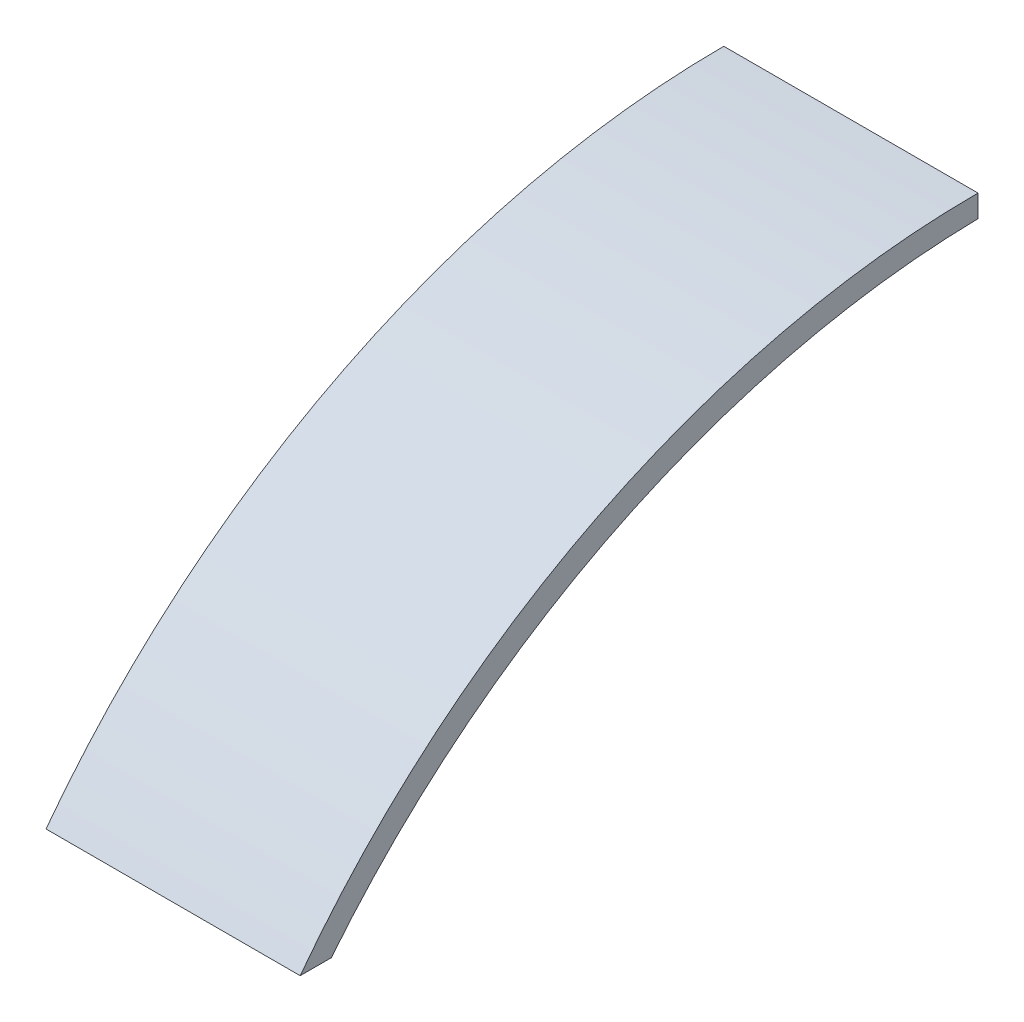
from build123d import *

# Parameters (mm, degrees)
BOSS_EXTRUDE1_DEPTH = 57.15


with BuildPart() as part:
    # Sketch2 → Boss-Extrude1 (new body)
    with BuildSketch(Plane(origin=(0, 0, 0), x_dir=(0, 0, -1), z_dir=(1, 0, 0))):
        with BuildLine():
            Line((152.4, 76.2), (152.4, 71.2))
            ThreePointArc((152.4, 71.2), (71.760072283, 51.81440295), (7, 0))
            Line((7, 0), (0, 0))
            ThreePointArc((0, 0), (67.205810057, 56.088379885), (152.4, 76.2))
        make_face()
    extrude(amount=BOSS_EXTRUDE1_DEPTH)


solid = part.part
